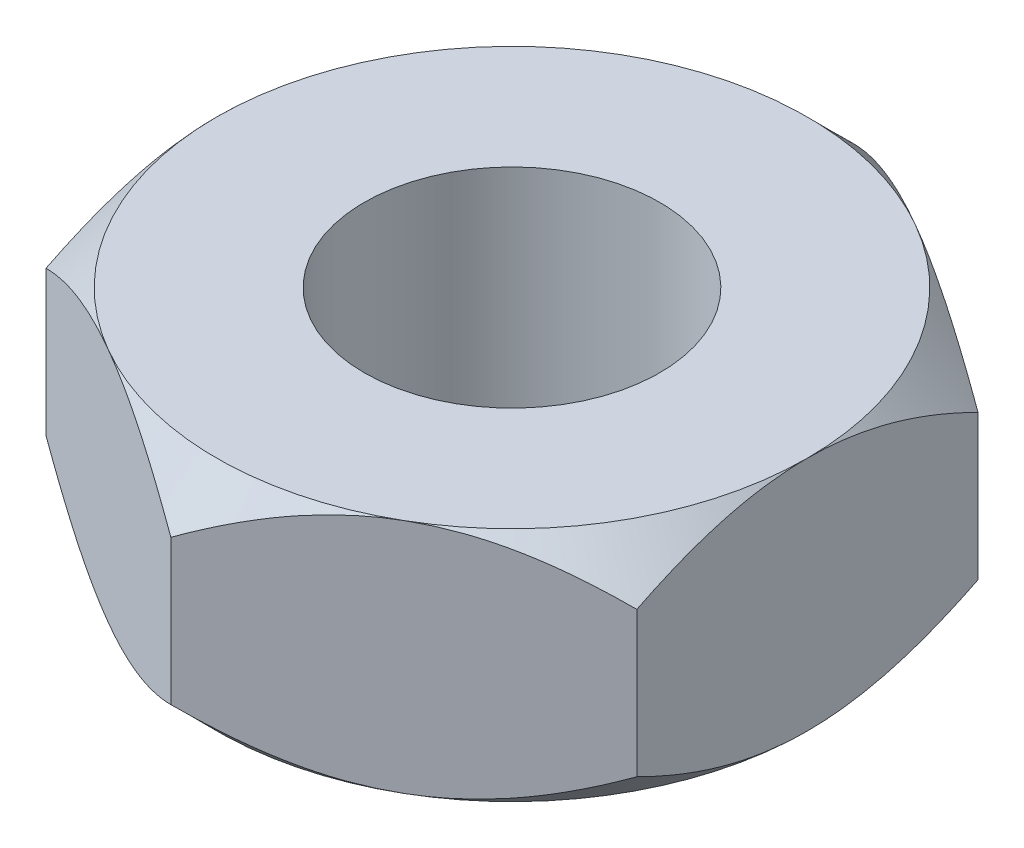
from build123d import *

# Parameters (mm, degrees)
SKETCH1_R           = 1
BOSS_EXTRUDE1_DEPTH = 1.6
SKETCH2_OUTSIDE_W   = 16.16
SKETCH2_OUTSIDE_H   = 16.778
SKETCH2_OUTSIDE_R   = 2
CUT_EXTRUDE1_DEPTH  = 4.448671242
CUT_EXTRUDE1_DRAFT  = -45
SKETCH3_OUTSIDE_W   = 16.16
SKETCH3_OUTSIDE_H   = 16.778
SKETCH3_OUTSIDE_R   = 2
CUT_EXTRUDE2_DEPTH  = 4.448671242
CUT_EXTRUDE2_DRAFT  = -45


with BuildPart() as part:
    # Sketch1 → Boss-Extrude1 (new body)
    with BuildSketch(Plane(origin=(0, 0, 0), x_dir=(1, 0, 0), z_dir=(0, 1, 0))):
        Polygon((0, 2.309401077), (-2, 1.154700538), (-2, -1.154700538), (0, -2.309401077), (2, -1.154700538), (2, 1.154700538), align=None)
        with Locations(Location((0, 0, 0), (0, 0, 270))):
            Circle(SKETCH1_R, mode=Mode.SUBTRACT)
    extrude(amount=BOSS_EXTRUDE1_DEPTH)


with BuildPart() as cut_extrude1_tool:
    # Sketch2 outside → Cut-Extrude1 (with draft: the straight prism first)
    with BuildSketch(Plane(origin=(0, 1.6, 0), x_dir=(1, 0, 0), z_dir=(0, 1, 0))):
        Rectangle(SKETCH2_OUTSIDE_W, SKETCH2_OUTSIDE_H)
        Circle(SKETCH2_OUTSIDE_R, mode=Mode.SUBTRACT)
    extrude(amount=-CUT_EXTRUDE1_DEPTH)
    # Cut-Extrude1: the draft: its side faces are tilted about the plane it starts from
    cut_extrude1_sides = [cut_extrude1_tool.faces().sort_by_distance(p)[0] for p in [
        (0, -0.624335621, 8.389),
        (8.08, -0.624335621, 0),
        (0, -0.624335621, -8.389),
        (-8.08, -0.624335621, 0),
        (-2, -0.624335621, 0),
    ]]
    draft(cut_extrude1_sides, Plane(origin=(0, 1.6, 0), x_dir=(1, 0, 0), z_dir=(0, 1, 0)), CUT_EXTRUDE1_DRAFT)


with BuildPart() as part_1:
    add(part.part)

    # Cut-Extrude1: cut by cut_extrude1_tool
    add(cut_extrude1_tool.part, mode=Mode.SUBTRACT)


with BuildPart() as cut_extrude2_tool:
    # Sketch3 outside → Cut-Extrude2 (with draft: the straight prism first)
    with BuildSketch(Plane.XZ):
        Rectangle(SKETCH3_OUTSIDE_W, SKETCH3_OUTSIDE_H)
        Circle(SKETCH3_OUTSIDE_R, mode=Mode.SUBTRACT)
    extrude(amount=-CUT_EXTRUDE2_DEPTH)
    # Cut-Extrude2: the draft: its side faces are tilted about the plane it starts from
    cut_extrude2_sides = [cut_extrude2_tool.faces().sort_by_distance(p)[0] for p in [
        (0, 2.224335621, -8.389),
        (8.08, 2.224335621, 0),
        (0, 2.224335621, 8.389),
        (-8.08, 2.224335621, 0),
        (-2, 2.224335621, 0),
    ]]
    draft(cut_extrude2_sides, Plane.XZ, CUT_EXTRUDE2_DRAFT)


with BuildPart() as part_2:
    add(part_1.part)

    # Cut-Extrude2: cut by cut_extrude2_tool
    add(cut_extrude2_tool.part, mode=Mode.SUBTRACT)


solid = part_2.part
